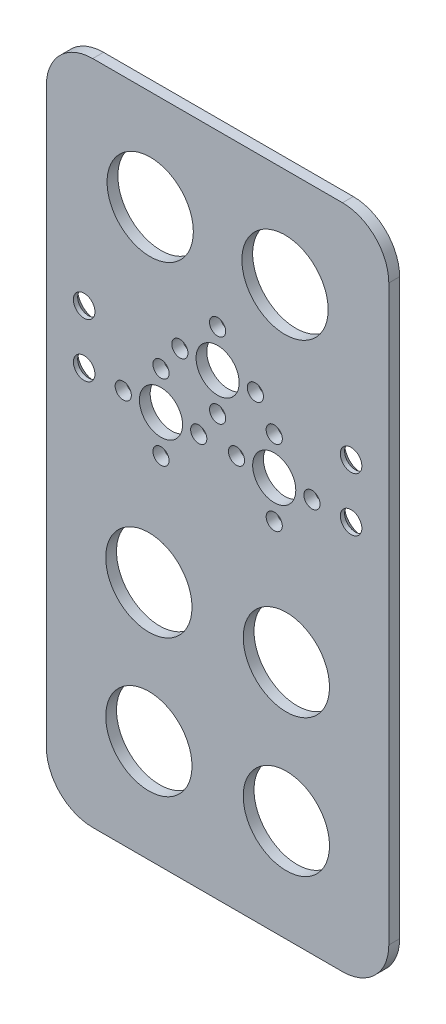
from build123d import *

# Parameters (mm, degrees)
SKETCH_1_R               = 8
SKETCH_1_R_2             = 2
SKETCH_1_R_3             = 4
SKETCH_1_R_4             = 1.5
EXTRUDE_1_DEPTH          = 2
HOLE_WIZARD_1_AT_2_COUNT = 2
HOLE_WIZARD_1_AT_2_PITCH = 10
HOLE_WIZARD_1_AT_3_COUNT = 2
HOLE_WIZARD_1_AT_3_PITCH = 50.5
HOLE_WIZARD_1_AT_4_COUNT = 2
HOLE_WIZARD_1_AT_4_PITCH = 49.5


with BuildPart() as part:
    # 草图1 → 凸台-拉伸1 (new body)
    with BuildSketch(Plane.XY):
        with BuildLine():
            Line((-23.162071109, -54.533023266), (23.162071109, -54.533023266))
            ThreePointArc((23.162071109, -54.533023266), (29.234653864, -52.01767713), (31.75, -45.945094375))
            Line((31.75, -45.945094375), (31.75, 60.379047844))
            ThreePointArc((31.75, 60.379047844), (29.234653864, 66.451630598), (23.162071109, 68.966976734))
            Line((23.162071109, 68.966976734), (-23.162071109, 68.966976734))
            ThreePointArc((-23.162071109, 68.966976734), (-29.234653864, 66.451630598), (-31.75, 60.379047844))
            Line((-31.75, 60.379047844), (-31.75, -45.945094375))
            ThreePointArc((-31.75, -45.945094375), (-29.234653864, -52.01767713), (-23.162071109, -54.533023266))
        make_face()
        with Locations((-12.5, 50.466976734)):
            Circle(SKETCH_1_R, mode=Mode.SUBTRACT)
        with Locations((12.5, 50.466976734)):
            Circle(SKETCH_1_R, mode=Mode.SUBTRACT)
        with Locations((-12.749904554, -35.463254167)):
            Circle(SKETCH_1_R, mode=Mode.SUBTRACT)
        with Locations((12.75, -35.533023266)):
            Circle(SKETCH_1_R, mode=Mode.SUBTRACT)
        with Locations((12.75, -10.033023266)):
            Circle(SKETCH_1_R, mode=Mode.SUBTRACT)
        with Locations((-12.749904554, -9.963254167)):
            Circle(SKETCH_1_R, mode=Mode.SUBTRACT)
        with Locations((24.75, 28.466976734)):
            Circle(SKETCH_1_R_2, mode=Mode.SUBTRACT)
        with Locations((24.75, 18.466976734)):
            Circle(SKETCH_1_R_2, mode=Mode.SUBTRACT)
        with Locations((-24.75, 28.466976734)):
            Circle(SKETCH_1_R_2, mode=Mode.SUBTRACT)
        with Locations((-24.75, 18.466976734)):
            Circle(SKETCH_1_R_2, mode=Mode.SUBTRACT)
        with Locations((0, 30.466976734)):
            Circle(SKETCH_1_R_3, mode=Mode.SUBTRACT)
        with Locations((-10.5, 18.466976734)):
            Circle(SKETCH_1_R_3, mode=Mode.SUBTRACT)
        with Locations((10.5, 18.466976734)):
            Circle(SKETCH_1_R_3, mode=Mode.SUBTRACT)
        with Locations((10.5, 25.466976734)):
            Circle(SKETCH_1_R_4, mode=Mode.SUBTRACT)
        with Locations((0, 37.466976734)):
            Circle(SKETCH_1_R_4, mode=Mode.SUBTRACT)
        with Locations((7, 30.466976734)):
            Circle(SKETCH_1_R_4, mode=Mode.SUBTRACT)
        with Locations((-10.5, 25.466976734)):
            Circle(SKETCH_1_R_4, mode=Mode.SUBTRACT)
        with Locations((0, 23.466976734)):
            Circle(SKETCH_1_R_4, mode=Mode.SUBTRACT)
        with Locations((-7, 30.466976734)):
            Circle(SKETCH_1_R_4, mode=Mode.SUBTRACT)
        with Locations((17.5, 18.466976734)):
            Circle(SKETCH_1_R_4, mode=Mode.SUBTRACT)
        with Locations((10.5, 11.466976734)):
            Circle(SKETCH_1_R_4, mode=Mode.SUBTRACT)
        with Locations((3.5, 18.466976734)):
            Circle(SKETCH_1_R_4, mode=Mode.SUBTRACT)
        with Locations((-3.5, 18.466976734)):
            Circle(SKETCH_1_R_4, mode=Mode.SUBTRACT)
        with Locations((-10.5, 11.466976734)):
            Circle(SKETCH_1_R_4, mode=Mode.SUBTRACT)
        with Locations((-17.5, 18.466976734)):
            Circle(SKETCH_1_R_4, mode=Mode.SUBTRACT)
    extrude(amount=EXTRUDE_1_DEPTH)

    # 草图4 → 打孔尺寸开槽半沉头螺钉的类型1 (revolve, cut)
    with BuildSketch(Plane(origin=(24.75, 28.466976734, 0), x_dir=(0, 1, 0), z_dir=(1, 0, 0))):
        Polygon((0, 0), (0, 3.021463052), (1.7, 2), (1.7, 1.5), (3.2, 0), align=None)
    hole_wizard_1 = revolve(axis=Axis((24.75, 28.466976734, -6.35), (0, 0, 1)), mode=Mode.SUBTRACT)

    # 打孔尺寸开槽半沉头螺钉的类型1 at 2: 打孔尺寸开槽半沉头螺钉的类型1 ×2
    with Locations(*[(0, -i * HOLE_WIZARD_1_AT_2_PITCH, 0) for i in range(1, HOLE_WIZARD_1_AT_2_COUNT)]):
        add(hole_wizard_1, mode=Mode.SUBTRACT)

    # 打孔尺寸开槽半沉头螺钉的类型1 at 3: 打孔尺寸开槽半沉头螺钉的类型1 ×2
    with Locations(*[Vector(-0.9801980198019802, -0.19801980198019808, 0) * (i * HOLE_WIZARD_1_AT_3_PITCH) for i in range(1, HOLE_WIZARD_1_AT_3_COUNT)]):
        add(hole_wizard_1, mode=Mode.SUBTRACT)

    # 打孔尺寸开槽半沉头螺钉的类型1 at 4: 打孔尺寸开槽半沉头螺钉的类型1 ×2
    with Locations(*[(-i * HOLE_WIZARD_1_AT_4_PITCH, 0, 0) for i in range(1, HOLE_WIZARD_1_AT_4_COUNT)]):
        add(hole_wizard_1, mode=Mode.SUBTRACT)


solid = part.part
